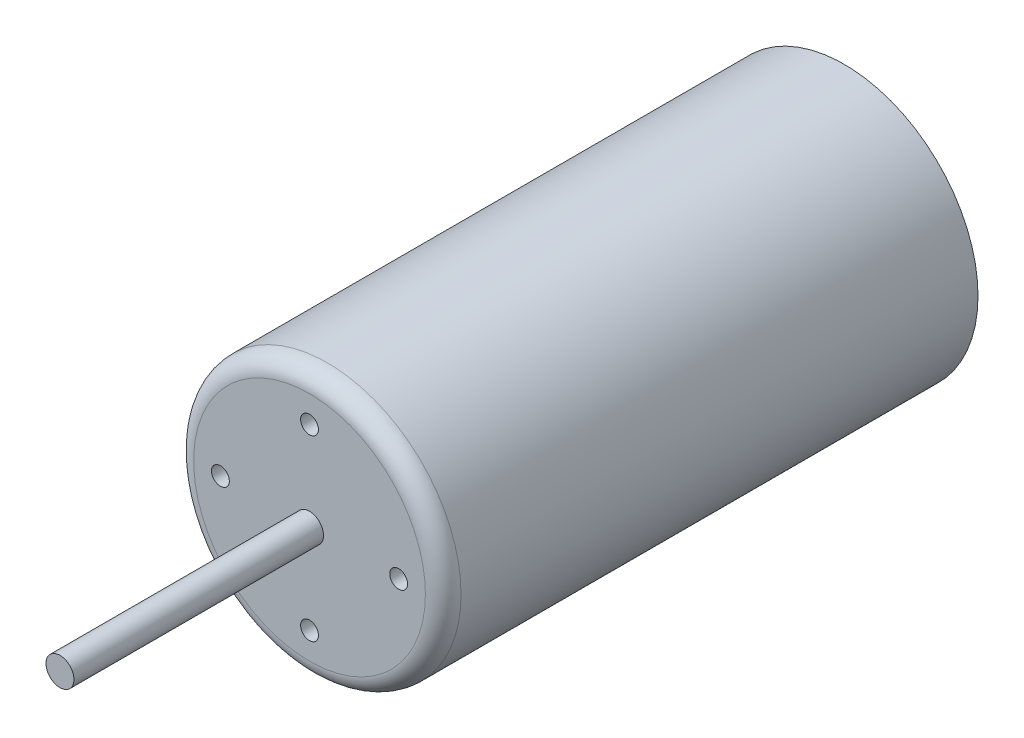
from build123d import *

# Parameters (mm, degrees)
SKETCH1_R           = 19.05
BOSS_EXTRUDE1_DEPTH = 76.2
FILLET2_R           = 2.54
SKETCH2_R           = 1.9939
BOSS_EXTRUDE2_DEPTH = 35.56
SKETCH3_R           = 1.27
CUT_EXTRUDE1_DEPTH  = 35.56


with BuildPart() as part:
    # Sketch1 → Boss-Extrude1 (new body)
    with BuildSketch(Plane.XY):
        Circle(SKETCH1_R)
    extrude(amount=BOSS_EXTRUDE1_DEPTH)

    # Fillet2
    fillet2_edges = [part.edges().sort_by_distance(p)[0] for p in [
        (-19.05, 0, 76.2),
    ]]
    fillet(fillet2_edges, radius=FILLET2_R)

    # Sketch2 → Boss-Extrude2 (add)
    with BuildSketch(Plane.XY.offset(76.2)):
        Circle(SKETCH2_R)
    extrude(amount=BOSS_EXTRUDE2_DEPTH)

    # Sketch3 → Cut-Extrude1 (cut)
    with BuildSketch(Plane.XY.offset(76.2)):
        with Locations((12.7, 0)):
            Circle(SKETCH3_R)
        with Locations((0, -12.7)):
            Circle(SKETCH3_R)
        with Locations((-12.7, 0)):
            Circle(SKETCH3_R)
        with Locations((0, 12.7)):
            Circle(SKETCH3_R)
    extrude(amount=-CUT_EXTRUDE1_DEPTH, mode=Mode.SUBTRACT)


solid = part.part
